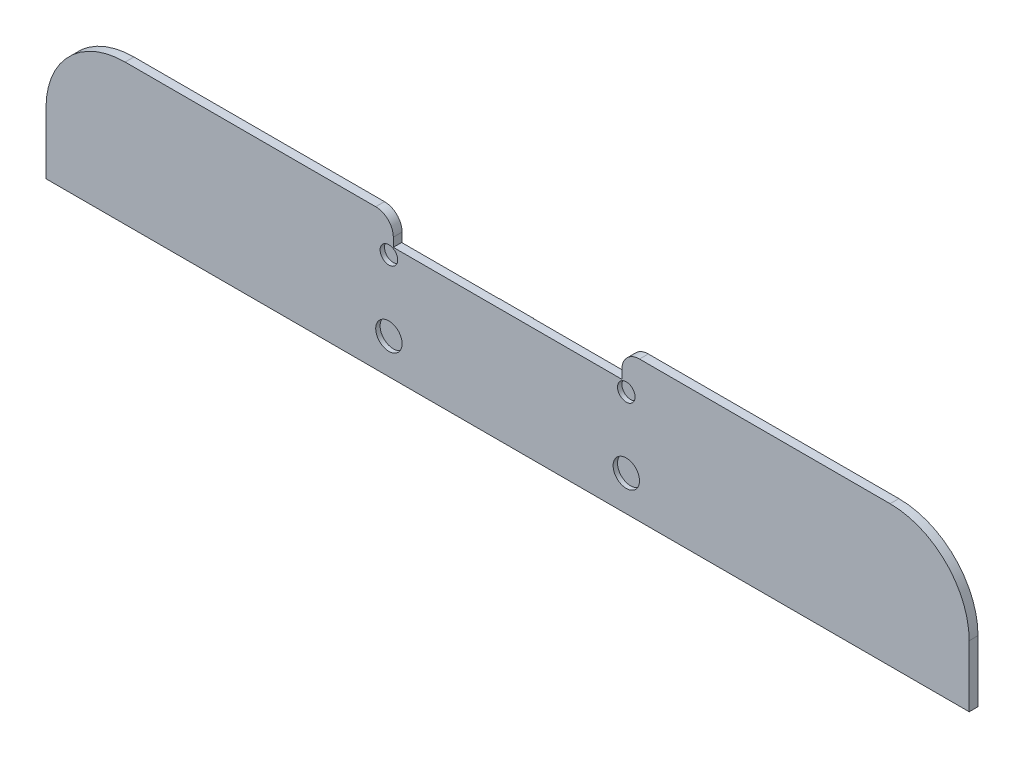
from build123d import *

# Parameters (mm, degrees)
SKETCH1_W           = 1050
SKETCH1_H           = 160
BOSS_EXTRUDE1_DEPTH = 10
SKETCH2_R           = 10
SKETCH2_R_2         = 15
CUT_EXTRUDE3_DEPTH  = 5
FILLET1_R           = 90
FILLET2_R           = 90
SKETCH3_W           = 260
SKETCH3_H           = 160
CUT_EXTRUDE4_DEPTH  = 0.5
SKETCH4_W           = 40
SKETCH4_H           = 160
BOSS_EXTRUDE2_DEPTH = 0.25
SKETCH5_W           = 260
SKETCH5_H           = 9.5
CUT_EXTRUDE5_DEPTH  = 30
SKETCH6_W           = 40
SKETCH6_H           = 30
CUT_EXTRUDE7_DEPTH  = 30
FILLET3_R           = 20
FILLET4_R           = 20


with BuildPart() as part:
    # Sketch1 → Boss-Extrude1 (new body)
    with BuildSketch(Plane.XY):
        Rectangle(SKETCH1_W, SKETCH1_H)
    extrude(amount=BOSS_EXTRUDE1_DEPTH)

    # Sketch2 → Cut-Extrude3 (cut)
    with BuildSketch(Plane.XY.offset(10)):
        with Locations((-135, 40)):
            Circle(SKETCH2_R)
        with Locations((135, 40)):
            Circle(SKETCH2_R)
        with Locations((135, -40)):
            Circle(SKETCH2_R_2)
        with Locations((-135, -40)):
            Circle(SKETCH2_R_2)
    extrude(amount=-CUT_EXTRUDE3_DEPTH, mode=Mode.SUBTRACT)

    # Fillet1
    fillet1_edges = [part.edges().sort_by_distance(p)[0] for p in [
        (525, 80, 5),
    ]]
    fillet(fillet1_edges, radius=FILLET1_R)

    # Fillet2
    fillet2_edges = [part.edges().sort_by_distance(p)[0] for p in [
        (-525, 80, 5),
    ]]
    fillet(fillet2_edges, radius=FILLET2_R)

    # Sketch3 → Cut-Extrude4 (cut)
    with BuildSketch(Plane(origin=(0, 0, 0), x_dir=(-1, 0, 0), z_dir=(0, 0, -1))):
        Rectangle(SKETCH3_W, SKETCH3_H)
    extrude(amount=-CUT_EXTRUDE4_DEPTH, mode=Mode.SUBTRACT)

    # Sketch4 → Boss-Extrude2 (add)
    with BuildSketch(Plane(origin=(0, 0, 0.5), x_dir=(-1, 0, 0), z_dir=(0, 0, -1))):
        Rectangle(SKETCH4_W, SKETCH4_H)
    extrude(amount=BOSS_EXTRUDE2_DEPTH)

    # Sketch5 → Cut-Extrude5 (cut)
    with BuildSketch(Plane(origin=(0, 80, 0), x_dir=(1, 0, 0), z_dir=(0, 1, 0))):
        with Locations((0, -5.25)):
            Rectangle(SKETCH5_W, SKETCH5_H)
    extrude(amount=-CUT_EXTRUDE5_DEPTH, mode=Mode.SUBTRACT)

    # Sketch6 → Cut-Extrude7 (cut)
    with BuildSketch(Plane(origin=(0, 0, 0.25), x_dir=(-1, 0, 0), z_dir=(0, 0, -1))):
        with Locations((0, 65)):
            Rectangle(SKETCH6_W, SKETCH6_H)
    extrude(amount=-CUT_EXTRUDE7_DEPTH, mode=Mode.SUBTRACT)

    # Fillet3
    fillet3_edges = [part.edges().sort_by_distance(p)[0] for p in [
        (130, 80, 5),
    ]]
    fillet(fillet3_edges, radius=FILLET3_R)

    # Fillet4
    fillet4_edges = [part.edges().sort_by_distance(p)[0] for p in [
        (-130, 80, 5),
    ]]
    fillet(fillet4_edges, radius=FILLET4_R)


solid = part.part
